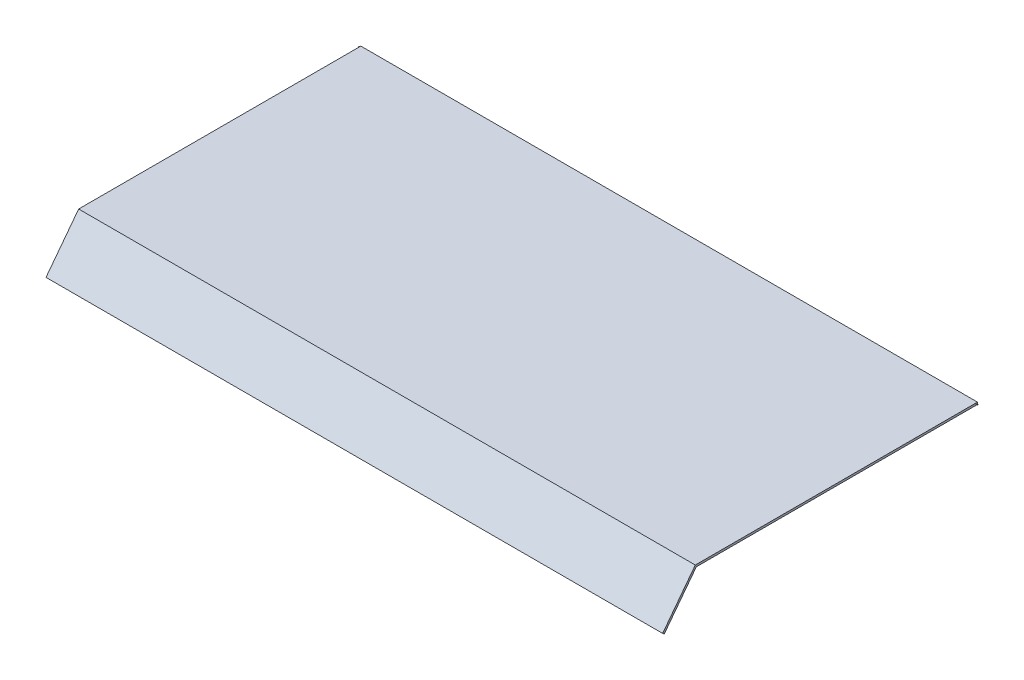
from build123d import *

# Parameters (mm, degrees)
SALIENTE_EXTRUIR1_DEPTH = 147.5
CROQUIS2_R              = 0.25
SALIENTE_EXTRUIR2_DEPTH = 0.5


with BuildPart() as part:
    # Croquis1 → Saliente-Extruir1 (new body)
    with BuildSketch(Plane(origin=(0, 0, 0), x_dir=(0, 0, -1), z_dir=(1, 0, 0))):
        Polygon((0, 0), (134.5, 0), (134.5, 1), (-0.495643149, 1), (-16.116757416, -19.527932056), (-15.320966749, -20.133503865), align=None)
    extrude(amount=SALIENTE_EXTRUIR1_DEPTH)

    # Croquis2 → Saliente-Extruir2 (add)
    with BuildSketch(Plane(origin=(147.5, 0, 0), x_dir=(0, 0, -1), z_dir=(1, 0, 0))):
        with Locations(Location((134, 0.5, 0), (0, 0, 180))):
            Circle(CROQUIS2_R)
    extrude(amount=SALIENTE_EXTRUIR2_DEPTH)

    # Simetría1: part across plane


with BuildPart() as part_1:
    add(part.part)
    add(part.part.mirror(Plane.ZY))


solid = part_1.part
